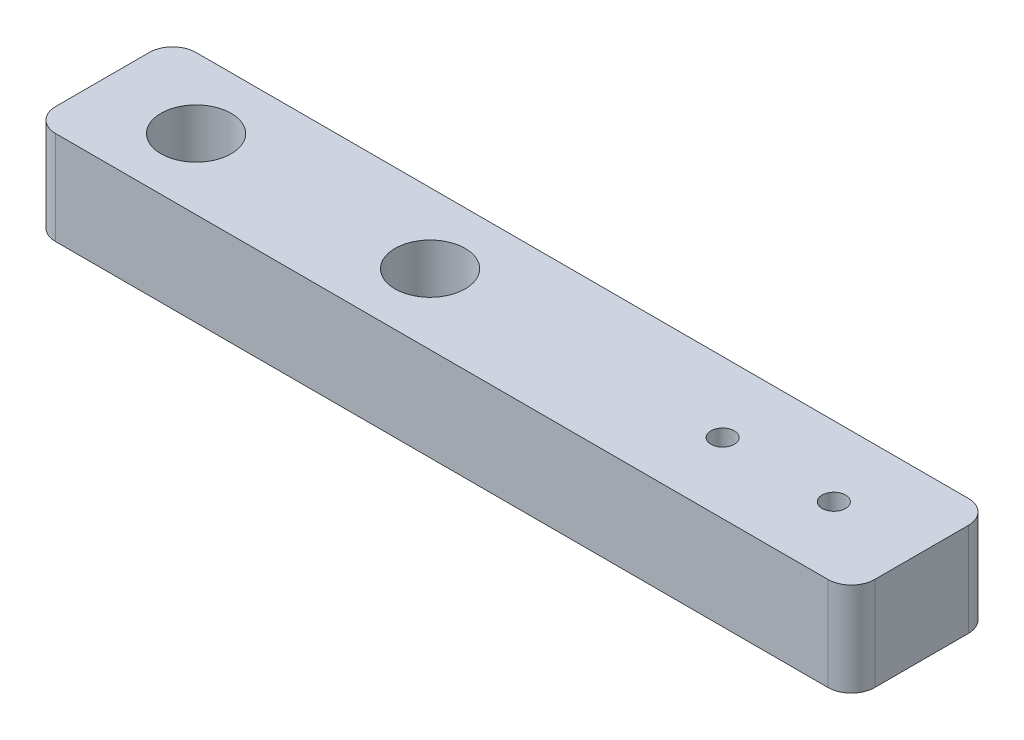
from build123d import *

# Parameters (mm, degrees)
SKETCH1_W           = 70
SKETCH1_H           = 12
BOSS_EXTRUDE1_DEPTH = 8
SKETCH2_R           = 3
SKETCH2_R_2         = 1
CUT_EXTRUDE1_DEPTH  = 37.400549446
FILLET1_R           = 2


with BuildPart() as part:
    # Sketch1 → Boss-Extrude1 (new body)
    with BuildSketch(Plane(origin=(0, 0, 0), x_dir=(1, 0, 0), z_dir=(0, 1, 0))):
        Rectangle(SKETCH1_W, SKETCH1_H)
    extrude(amount=BOSS_EXTRUDE1_DEPTH)

    # Sketch2 → Cut-Extrude1 (cut, through all)
    with BuildSketch(Plane(origin=(0, 8, 0), x_dir=(1, 0, 0), z_dir=(0, 1, 0))):
        with Locations(Location((-27, 0, 0), (0, 0, 270))):
            Circle(SKETCH2_R)
        with Locations(Location((-7, 0, 0), (0, 0, 270))):
            Circle(SKETCH2_R)
        with Locations(Location((18, 0, 0), (0, 0, 270))):
            Circle(SKETCH2_R_2)
        with Locations(Location((27.5, 0, 0), (0, 0, 270))):
            Circle(SKETCH2_R_2)
    extrude(amount=-CUT_EXTRUDE1_DEPTH, mode=Mode.SUBTRACT)

    # Fillet1
    fillet1_edges = [part.edges().sort_by_distance(p)[0] for p in [
        (35, 4, 6),
        (-35, 4, 6),
        (-35, 4, -6),
        (35, 4, -6),
    ]]
    fillet(fillet1_edges, radius=FILLET1_R)


solid = part.part
